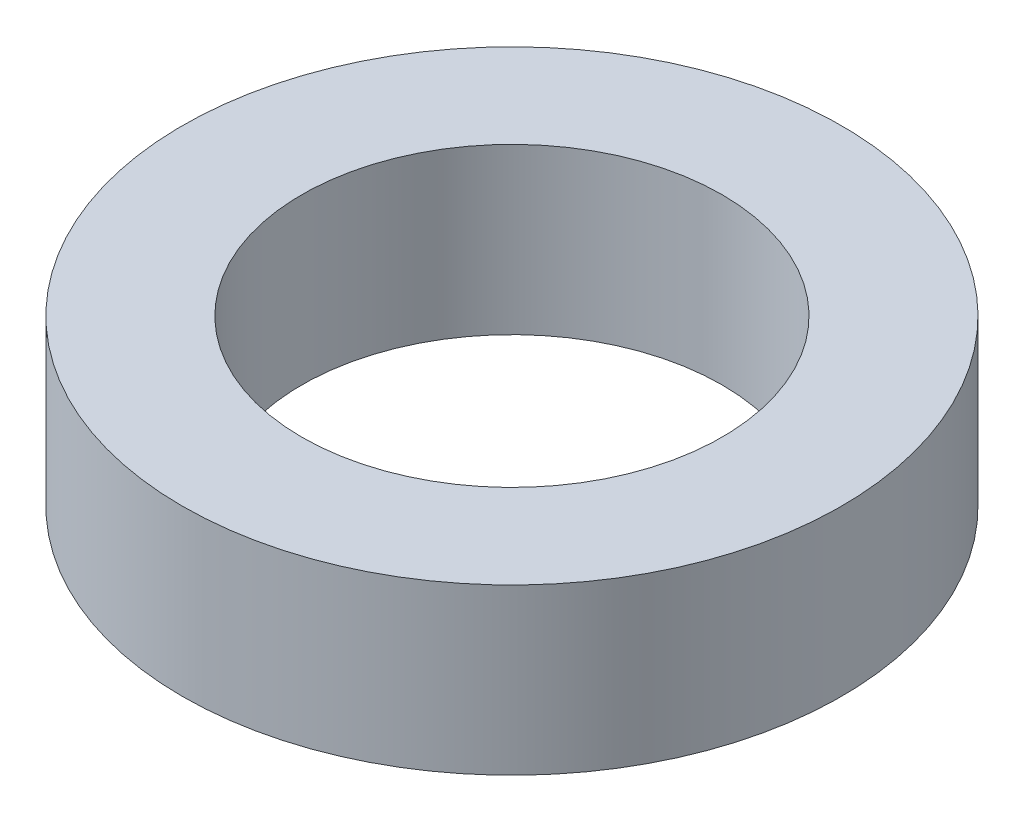
from build123d import *

# Parameters (mm, degrees)
SKETCH1_R           = 4
SKETCH1_R_2         = 2.55
BOSS_EXTRUDE1_DEPTH = 2


with BuildPart() as part:
    # Sketch1 → Boss-Extrude1 (new body)
    with BuildSketch(Plane(origin=(0, 0, 0), x_dir=(1, 0, 0), z_dir=(0, 1, 0))):
        with Locations(Location((0, 0, 0), (0, 0, 270))):
            Circle(SKETCH1_R)
        with Locations(Location((0, 0, 0), (0, 0, 270))):
            Circle(SKETCH1_R_2, mode=Mode.SUBTRACT)
    extrude(amount=BOSS_EXTRUDE1_DEPTH)


solid = part.part
